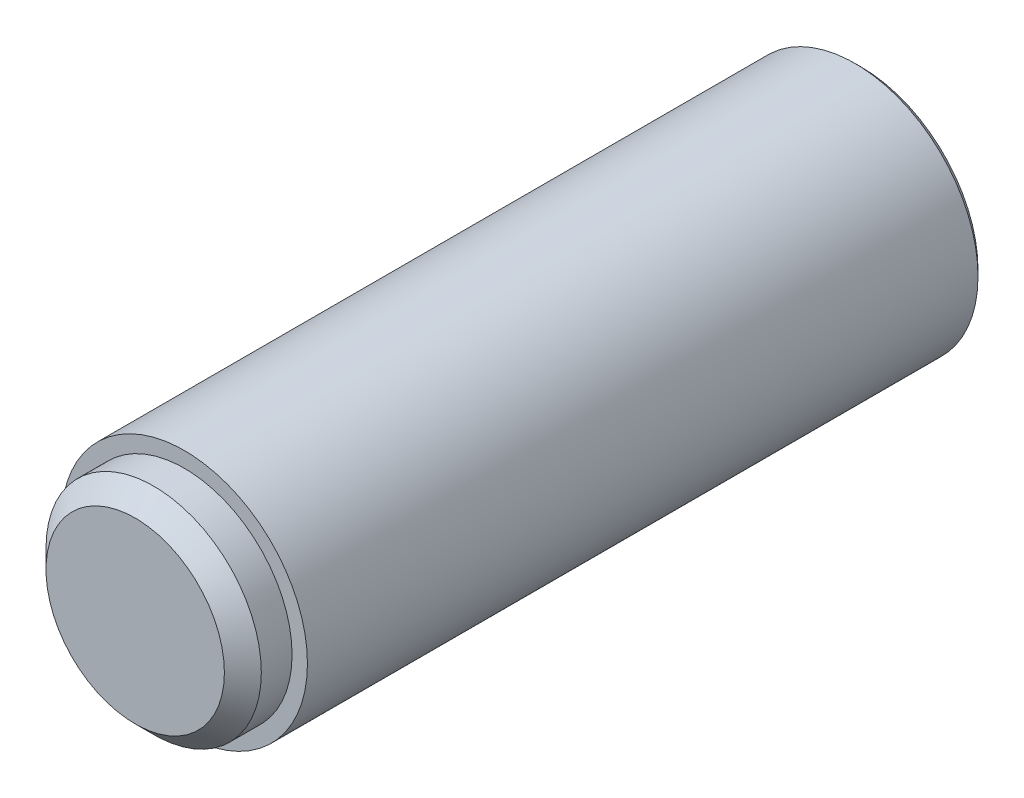
from build123d import *

# Parameters (mm, degrees)
SKETCH_1_R      = 20
EXTRUDE_1_DEPTH = 110
SKETCH_2_R      = 17.5
EXTRUDE_2_DEPTH = 8
CHAMFER_1_SIZE  = 3
CHAMFER_2_SIZE  = 1


with BuildPart() as part:
    # 草图1 → 凸台-拉伸1 (new body)
    with BuildSketch(Plane.XY):
        Circle(SKETCH_1_R)
    extrude(amount=EXTRUDE_1_DEPTH)

    # 草图2 → 凸台-拉伸2 (add)
    with BuildSketch(Plane.XY.offset(110)):
        Circle(SKETCH_2_R)
    extrude(amount=EXTRUDE_2_DEPTH)

    # 倒角1
    chamfer_1_edges = [part.edges().sort_by_distance(p)[0] for p in [
        (-17.5, 0, 118),
    ]]
    chamfer(chamfer_1_edges, length=CHAMFER_1_SIZE)

    # 倒角2
    chamfer_2_edges = [part.edges().sort_by_distance(p)[0] for p in [
        (-20, 0, 0),
    ]]
    chamfer(chamfer_2_edges, length=CHAMFER_2_SIZE)


solid = part.part
